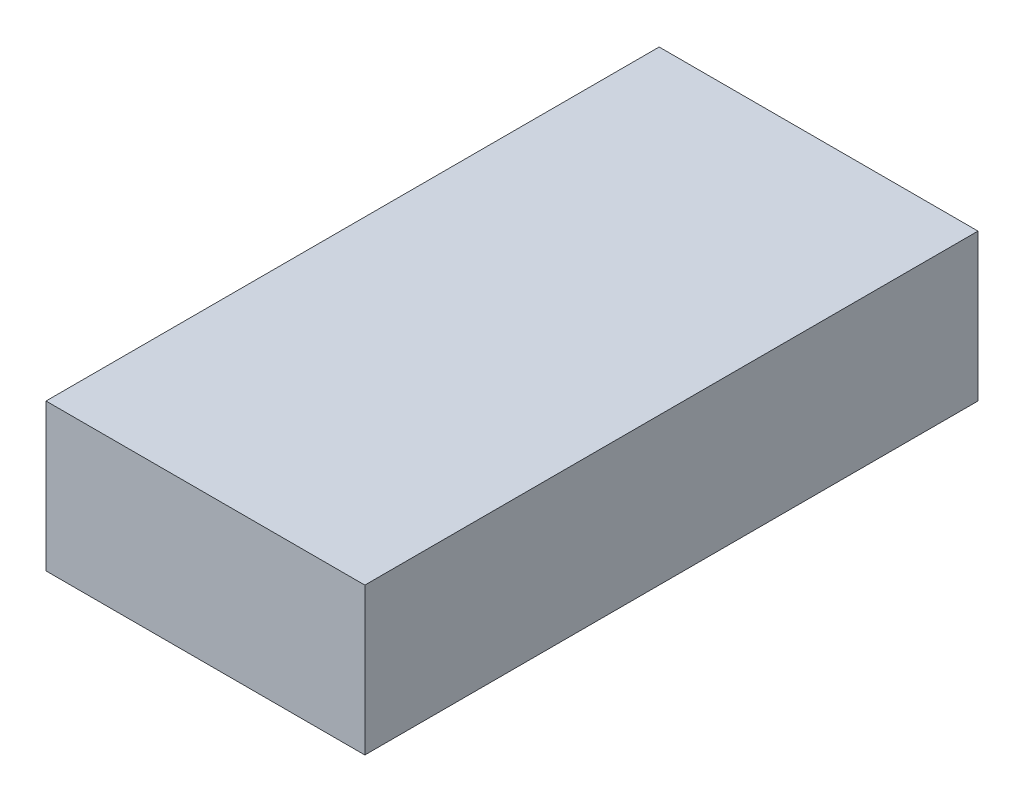
from build123d import *

# Parameters (mm, degrees)
SKETCH_1_W      = 26
SKETCH_1_H      = 50
EXTRUDE_1_DEPTH = 12


with BuildPart() as part:
    # 草图1 → 凸台-拉伸1 (new body)
    with BuildSketch(Plane(origin=(0, 0, 0), x_dir=(1, 0, 0), z_dir=(0, 1, 0))):
        Rectangle(SKETCH_1_W, SKETCH_1_H)
    extrude(amount=EXTRUDE_1_DEPTH)


solid = part.part
